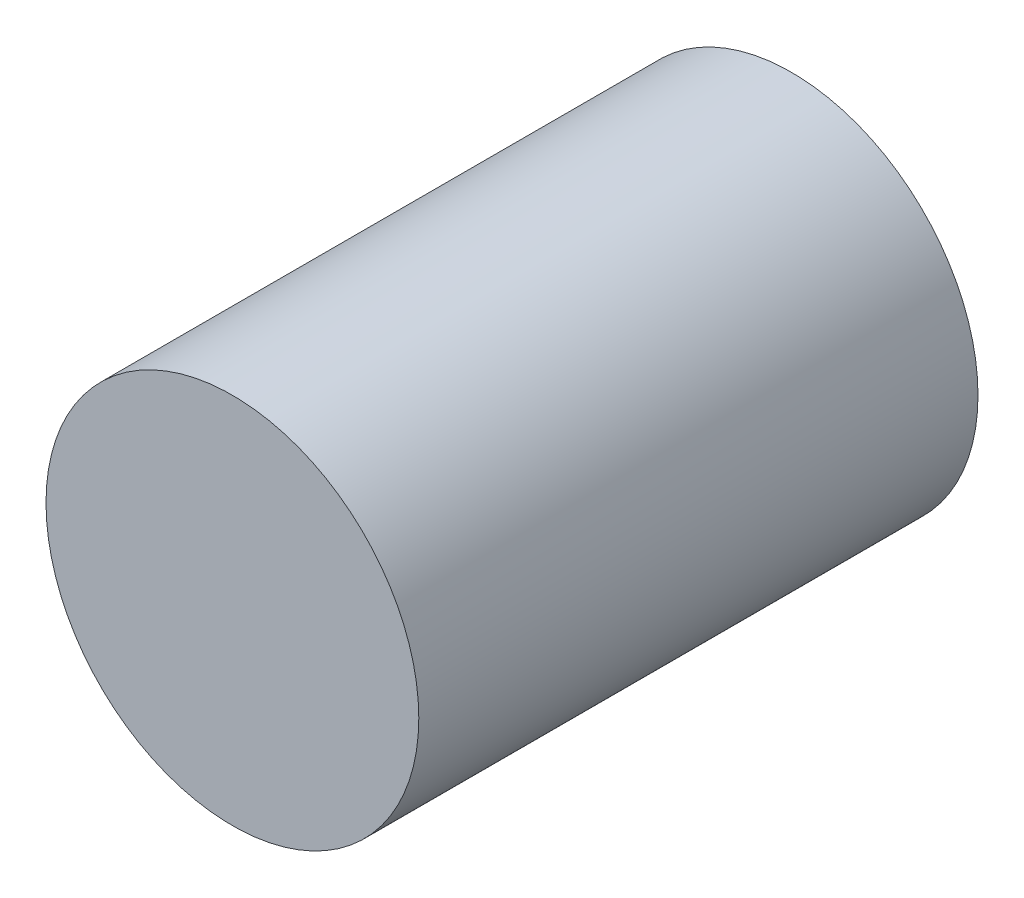
from build123d import *

# Parameters (mm, degrees)
SKETCH2_R           = 1
BOSS_EXTRUDE1_DEPTH = 3


with BuildPart() as part:
    # Sketch2 → Boss-Extrude1 (new body)
    with BuildSketch(Plane.XY):
        Circle(SKETCH2_R)
    extrude(amount=BOSS_EXTRUDE1_DEPTH)


solid = part.part
